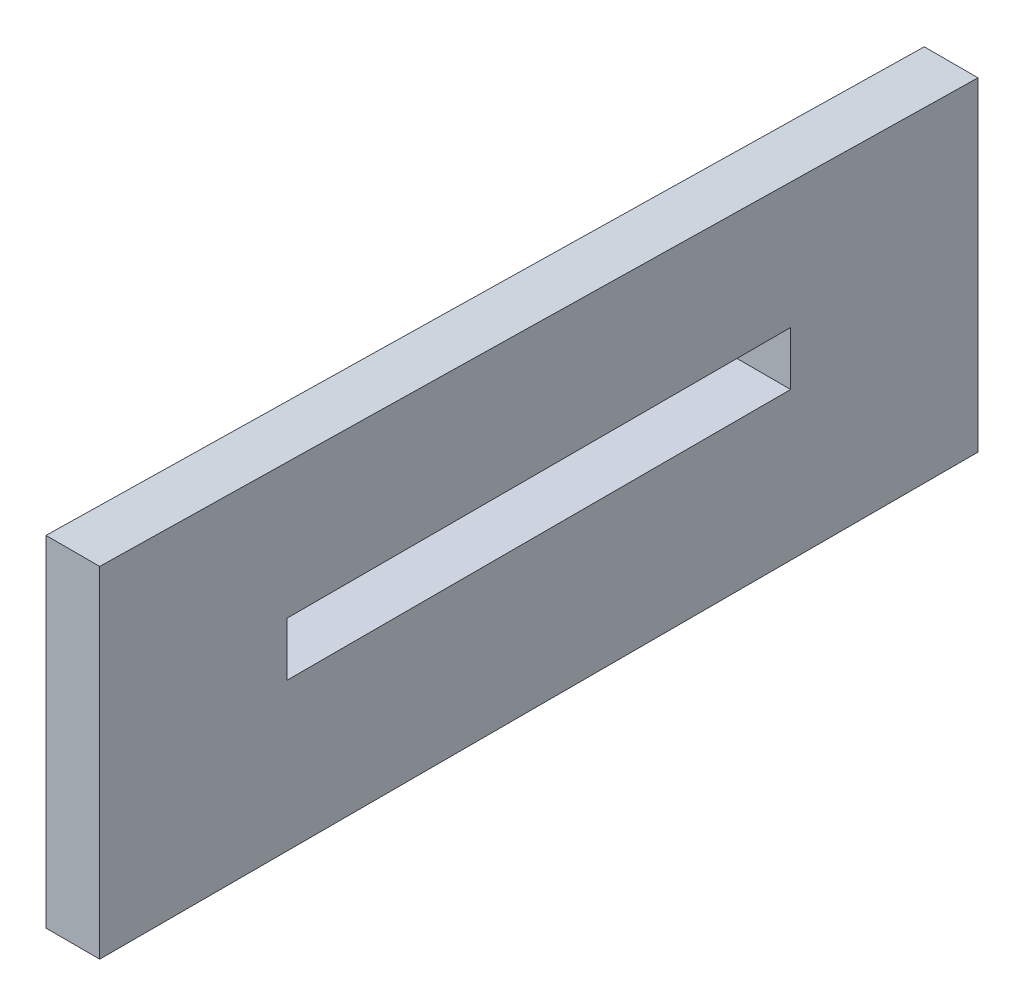
from build123d import *

# Parameters (mm, degrees)
SKETCH1_W           = 29.762241974
SKETCH1_H           = 3.175
BOSS_EXTRUDE1_DEPTH = 3.175


with BuildPart() as part:
    # Sketch1 → Boss-Extrude1 (new body)
    with BuildSketch(Plane(origin=(0, 0, 0), x_dir=(0, 0, -1), z_dir=(1, 0, 0))):
        Polygon((25.953850429, 9.579468141), (-25.953850429, 10.525064421), (-25.953850429, -9.579468141), (25.953850429, -9.579468141), align=None)
        with Locations((0, 0.751086509)):
            Rectangle(SKETCH1_W, SKETCH1_H, mode=Mode.SUBTRACT)
    extrude(amount=BOSS_EXTRUDE1_DEPTH)


solid = part.part
